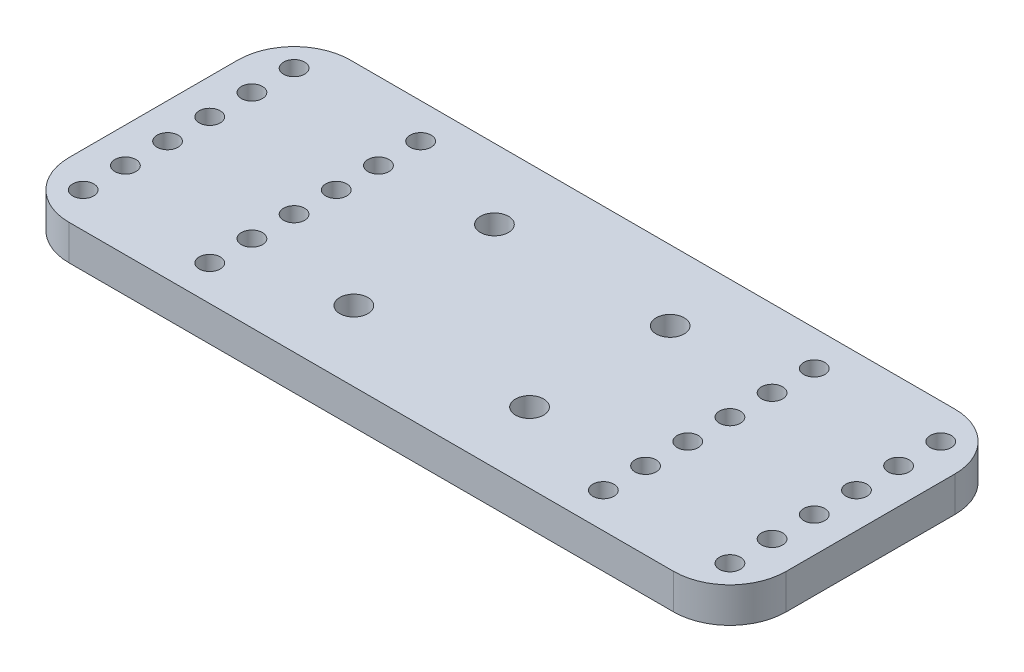
from build123d import *

# Parameters (mm, degrees)
SKETCH_1_W          = 102
SKETCH_1_H          = 40
EXTRUDE_1_DEPTH     = 5
SKETCH_2_R          = 1.5
CUT_EXTRUDE_1_DEPTH = 56.009090158
SKETCH_3_R          = 2
CUT_EXTRUDE_2_DEPTH = 5
FILLET_1_R          = 8


with BuildPart() as part:
    # 草图1 → 凸台-拉伸1 (new body)
    with BuildSketch(Plane(origin=(0, 0, 0), x_dir=(1, 0, 0), z_dir=(0, 1, 0))):
        Rectangle(SKETCH_1_W, SKETCH_1_H)
    extrude(amount=EXTRUDE_1_DEPTH)

    # 草图2 → 切除-拉伸1 (cut, through all)
    with BuildSketch(Plane(origin=(0, 5, 0), x_dir=(1, 0, 0), z_dir=(0, 1, 0))):
        with Locations((-46, 3)):
            Circle(SKETCH_2_R)
        with Locations((-28, 3)):
            Circle(SKETCH_2_R)
        with Locations((-28, -3)):
            Circle(SKETCH_2_R)
        with Locations((-46, -3)):
            Circle(SKETCH_2_R)
        with Locations((-28, 15)):
            Circle(SKETCH_2_R)
        with Locations((-28, 9)):
            Circle(SKETCH_2_R)
        with Locations((-46, 15)):
            Circle(SKETCH_2_R)
        with Locations((-46, 9)):
            Circle(SKETCH_2_R)
        with Locations((-46, -9)):
            Circle(SKETCH_2_R)
        with Locations((-46, -15)):
            Circle(SKETCH_2_R)
        with Locations((-28, -9)):
            Circle(SKETCH_2_R)
        with Locations((-28, -15)):
            Circle(SKETCH_2_R)
        with Locations((28, -15)):
            Circle(SKETCH_2_R)
        with Locations((28, -9)):
            Circle(SKETCH_2_R)
        with Locations((46, -15)):
            Circle(SKETCH_2_R)
        with Locations((46, -9)):
            Circle(SKETCH_2_R)
        with Locations((46, 9)):
            Circle(SKETCH_2_R)
        with Locations((46, 15)):
            Circle(SKETCH_2_R)
        with Locations((28, 9)):
            Circle(SKETCH_2_R)
        with Locations((28, 15)):
            Circle(SKETCH_2_R)
        with Locations((46, -3)):
            Circle(SKETCH_2_R)
        with Locations((28, -3)):
            Circle(SKETCH_2_R)
        with Locations((28, 3)):
            Circle(SKETCH_2_R)
        with Locations((46, 3)):
            Circle(SKETCH_2_R)
    extrude(amount=-CUT_EXTRUDE_1_DEPTH, mode=Mode.SUBTRACT)

    # 草图3 → 切除-拉伸2 (cut)
    with BuildSketch(Plane(origin=(0, 5, 0), x_dir=(1, 0, 0), z_dir=(0, 1, 0))):
        with Locations((-12.5, 10)):
            Circle(SKETCH_3_R)
        with Locations((12.5, 10)):
            Circle(SKETCH_3_R)
        with Locations((12.5, -10)):
            Circle(SKETCH_3_R)
        with Locations((-12.5, -10)):
            Circle(SKETCH_3_R)
    extrude(amount=-CUT_EXTRUDE_2_DEPTH, mode=Mode.SUBTRACT)

    # 圆角1
    fillet_1_edges = [part.edges().sort_by_distance(p)[0] for p in [
        (51, 2.5, -20),
        (51, 2.5, 20),
        (-51, 2.5, 20),
        (-51, 2.5, -20),
    ]]
    fillet(fillet_1_edges, radius=FILLET_1_R)


solid = part.part
